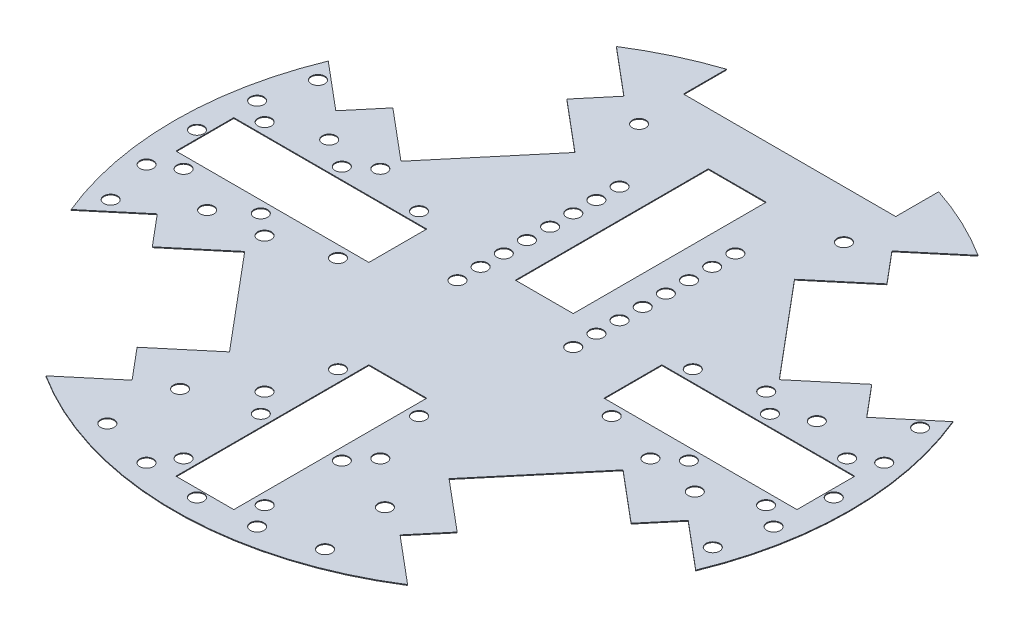
from build123d import *

# Parameters (mm, degrees)
SKETCH2_R                                  = 87.5
BOSS_EXTRUDE1_DEPTH                        = 0.2
SKETCH4_W                                  = 55
SKETCH4_H                                  = 31.14
CUT_EXTRUDE1_DEPTH                         = 173.2
SKETCH5_R                                  = 1.75
CUT_EXTRUDE3_DEPTH                         = 183.2
MIRROR2_AT_THE_SECOND_PLANE_COPY_1_SKETC_R = 1.75
MIRROR2_AT_THE_SECOND_PLANE_COPY_1_DEPTH   = 183.2
CUT_EXTRUDE4_DEPTH                         = 39
CUT_EXTRUDE4_DEPTH_BACK                    = 55
SKETCH9_R                                  = 1.75
SKETCH9_W                                  = 15
SKETCH9_H                                  = 50
SKETCH9_W_2                                = 50
SKETCH9_H_2                                = 15


with BuildPart() as part:
    # Sketch2 → Boss-Extrude1 (new body)
    with BuildSketch(Plane(origin=(0, 0, 0), x_dir=(1, 0, 0), z_dir=(0, 1, 0))):
        with Locations(Location((0, 0, 0), (0, 0, 270))):
            Circle(SKETCH2_R)
    extrude(amount=BOSS_EXTRUDE1_DEPTH)

    # Sketch4 → Cut-Extrude1 (cut)
    with BuildSketch(Plane(origin=(0, 10, 0), x_dir=(1, 0, 0), z_dir=(0, 1, 0))):
        with Locations((0, 87.5)):
            Rectangle(SKETCH4_W, SKETCH4_H)
    extrude(amount=-CUT_EXTRUDE1_DEPTH, mode=Mode.SUBTRACT)

    # Sketch5 → Cut-Extrude3 (cut)
    with BuildSketch(Plane(origin=(0, 0.2, 0), x_dir=(1, 0, 0), z_dir=(0, 1, 0))):
        with Locations(Location((-26.538332841, 59.472413045, 0), (0, 0, 270))):
            Circle(SKETCH5_R)
        with Locations(Location((-63.177226594, 15.807879787, 0), (0, 0, 270))):
            Circle(SKETCH5_R)
        Polygon((-46.847070053, 73.902652371), (-34.718308049, 63.725412646), (-41.467577951, 55.681945993), (-28.444822418, 44.754556629), (-49.014025927, 20.241134449), (-62.036781461, 31.168523814), (-68.786051362, 23.125057161), (-80.914813367, 33.302296885), (-94.831562428, 44.97983589), (-60.763819115, 85.580191376), align=None)
    cut_extrude3 = extrude(amount=-CUT_EXTRUDE3_DEPTH, mode=Mode.SUBTRACT)

    # Mirror2: Cut-Extrude3 across plane
    add(cut_extrude3.mirror(Plane.XY), mode=Mode.SUBTRACT)

    # Mirror2 at the second plane: Cut-Extrude3 across plane
    add(cut_extrude3.mirror(Plane(origin=(0, 0, 0), x_dir=(0, 0, 1), z_dir=(1, 0, 0))), mode=Mode.SUBTRACT)

    # Mirror2 at the second plane copy 1 sketc → Mirror2 at the second plane copy 1 (cut)
    with BuildSketch(Plane(origin=(0, 0.2, 0), x_dir=(-1, 0, 0), z_dir=(0, 1, 0))):
        with Locations(Location((-26.538332841, 59.472413045, 0), (0, 0, 270))):
            Circle(MIRROR2_AT_THE_SECOND_PLANE_COPY_1_SKETC_R)
        with Locations(Location((-63.177226594, 15.807879787, 0), (0, 0, 270))):
            Circle(MIRROR2_AT_THE_SECOND_PLANE_COPY_1_SKETC_R)
        Polygon((-46.847070053, 73.902652371), (-34.718308049, 63.725412646), (-41.467577951, 55.681945993), (-28.444822418, 44.754556629), (-49.014025927, 20.241134449), (-62.036781461, 31.168523814), (-68.786051362, 23.125057161), (-80.914813367, 33.302296885), (-94.831562428, 44.97983589), (-60.763819115, 85.580191376), align=None)
    extrude(amount=-MIRROR2_AT_THE_SECOND_PLANE_COPY_1_DEPTH, mode=Mode.SUBTRACT)

    # Sketch9 → Cut-Extrude4 (cut, two sides: drawn at the far end of the back side and taken through both)
    with BuildSketch(Plane(origin=(0, 10, 0), x_dir=(1, 0, 0), z_dir=(0, 1, 0)).offset(-CUT_EXTRUDE4_DEPTH_BACK)):
        with Locations(Location((-15, 0.875, 0), (0, 0, 270))):
            Circle(SKETCH9_R)
        with Locations(Location((15, 0.875, 0), (0, 0, 270))):
            Circle(SKETCH9_R)
        with Locations(Location((15, 6.875, 0), (0, 0, 270))):
            Circle(SKETCH9_R)
        with Locations(Location((-15, 6.875, 0), (0, 0, 270))):
            Circle(SKETCH9_R)
        with Locations(Location((-15, 12.875, 0), (0, 0, 270))):
            Circle(SKETCH9_R)
        with Locations(Location((15, 12.875, 0), (0, 0, 270))):
            Circle(SKETCH9_R)
        with Locations(Location((-15, 18.875, 0), (0, 0, 270))):
            Circle(SKETCH9_R)
        with Locations(Location((15, 18.875, 0), (0, 0, 270))):
            Circle(SKETCH9_R)
        with Locations(Location((-15, 24.875, 0), (0, 0, 270))):
            Circle(SKETCH9_R)
        with Locations(Location((15, 24.875, 0), (0, 0, 270))):
            Circle(SKETCH9_R)
        with Locations(Location((-15, 30.875, 0), (0, 0, 270))):
            Circle(SKETCH9_R)
        with Locations(Location((15, 30.875, 0), (0, 0, 270))):
            Circle(SKETCH9_R)
        with Locations(Location((-15, 36.875, 0), (0, 0, 270))):
            Circle(SKETCH9_R)
        with Locations(Location((15, 36.875, 0), (0, 0, 270))):
            Circle(SKETCH9_R)
        with Locations(Location((-15, 42.875, 0), (0, 0, 270))):
            Circle(SKETCH9_R)
        with Locations(Location((15, 42.875, 0), (0, 0, 270))):
            Circle(SKETCH9_R)
        with Locations(Location((-35.463524622, 11.375, 0), (0, 0, 270))):
            Circle(SKETCH9_R)
        with Locations(Location((-35.463524622, -9.625, 0), (0, 0, 270))):
            Circle(SKETCH9_R)
        with Locations(Location((-55.463524622, -9.625, 0), (0, 0, 270))):
            Circle(SKETCH9_R)
        with Locations(Location((-55.463524622, 11.375, 0), (0, 0, 270))):
            Circle(SKETCH9_R)
        with Locations(Location((-75.463524622, -9.625, 0), (0, 0, 270))):
            Circle(SKETCH9_R)
        with Locations(Location((-75.463524622, 11.375, 0), (0, 0, 270))):
            Circle(SKETCH9_R)
        with Locations(Location((-50, -14.125, 0), (0, 0, 270))):
            Circle(SKETCH9_R)
        with Locations(Location((-50, 15.875, 0), (0, 0, 270))):
            Circle(SKETCH9_R)
        with Locations(Location((-82.5, 0.875, 0), (0, 0, 270))):
            Circle(SKETCH9_R)
        with Locations(Location((-78.005282487, -25.984372743, 0), (0, 0, 270))):
            Circle(SKETCH9_R)
        with Locations(Location((-81.246639624, -13.450974658, 0), (0, 0, 270))):
            Circle(SKETCH9_R)
        with Locations(Location((-81.246639624, 15.200974658, 0), (0, 0, 270))):
            Circle(SKETCH9_R)
        with Locations(Location((-78.005282487, 27.734372743, 0), (0, 0, 270))):
            Circle(SKETCH9_R)
        with Locations(Location((28.216661824, -76.649641215, 0), (0, 0, 270))):
            Circle(SKETCH9_R)
        with Locations(Location((14.325974658, -80.371639624, 0), (0, 0, 270))):
            Circle(SKETCH9_R)
        with Locations(Location((10.5, -74.588524622, 0), (0, 0, 270))):
            Circle(SKETCH9_R)
        with Locations(Location((10.5, -54.588524622, 0), (0, 0, 270))):
            Circle(SKETCH9_R)
        with Locations(Location((15, -49.125, 0), (0, 0, 270))):
            Circle(SKETCH9_R)
        with Locations(Location((10.5, -34.588524622, 0), (0, 0, 270))):
            Circle(SKETCH9_R)
        with Locations(Location((0, -81.625, 0), (0, 0, 270))):
            Circle(SKETCH9_R)
        with Locations(Location((-14.325974658, -80.371639624, 0), (0, 0, 270))):
            Circle(SKETCH9_R)
        with Locations(Location((-28.216661824, -76.649641215, 0), (0, 0, 270))):
            Circle(SKETCH9_R)
        with Locations(Location((-10.5, -74.588524622, 0), (0, 0, 270))):
            Circle(SKETCH9_R)
        with Locations(Location((-10.5, -54.588524622, 0), (0, 0, 270))):
            Circle(SKETCH9_R)
        with Locations(Location((-15, -49.125, 0), (0, 0, 270))):
            Circle(SKETCH9_R)
        with Locations(Location((-10.5, -34.588524622, 0), (0, 0, 270))):
            Circle(SKETCH9_R)
        with Locations(Location((78.005282487, 27.734372743, 0), (0, 0, 270))):
            Circle(SKETCH9_R)
        with Locations(Location((81.246639624, 15.200974658, 0), (0, 0, 270))):
            Circle(SKETCH9_R)
        with Locations(Location((75.463524622, 11.375, 0), (0, 0, 270))):
            Circle(SKETCH9_R)
        with Locations(Location((55.463524622, 11.375, 0), (0, 0, 270))):
            Circle(SKETCH9_R)
        with Locations(Location((50, 15.875, 0), (0, 0, 270))):
            Circle(SKETCH9_R)
        with Locations(Location((35.463524622, 11.375, 0), (0, 0, 270))):
            Circle(SKETCH9_R)
        with Locations(Location((82.5, 0.875, 0), (0, 0, 270))):
            Circle(SKETCH9_R)
        with Locations(Location((81.246639624, -13.450974658, 0), (0, 0, 270))):
            Circle(SKETCH9_R)
        with Locations(Location((78.005282487, -25.984372743, 0), (0, 0, 270))):
            Circle(SKETCH9_R)
        with Locations(Location((75.463524622, -9.625, 0), (0, 0, 270))):
            Circle(SKETCH9_R)
        with Locations(Location((55.463524622, -9.625, 0), (0, 0, 270))):
            Circle(SKETCH9_R)
        with Locations(Location((50, -14.125, 0), (0, 0, 270))):
            Circle(SKETCH9_R)
        with Locations(Location((35.463524622, -9.625, 0), (0, 0, 270))):
            Circle(SKETCH9_R)
        with Locations((0, 33.375)):
            Rectangle(SKETCH9_W, SKETCH9_H)
        with Locations((-55.463524622, 0.875)):
            Rectangle(SKETCH9_W_2, SKETCH9_H_2)
        with Locations((0, -54.588524622)):
            Rectangle(SKETCH9_W, SKETCH9_H)
        with Locations((55.463524622, 0.875)):
            Rectangle(SKETCH9_W_2, SKETCH9_H_2)
    extrude(amount=CUT_EXTRUDE4_DEPTH + CUT_EXTRUDE4_DEPTH_BACK, mode=Mode.SUBTRACT)


solid = part.part
